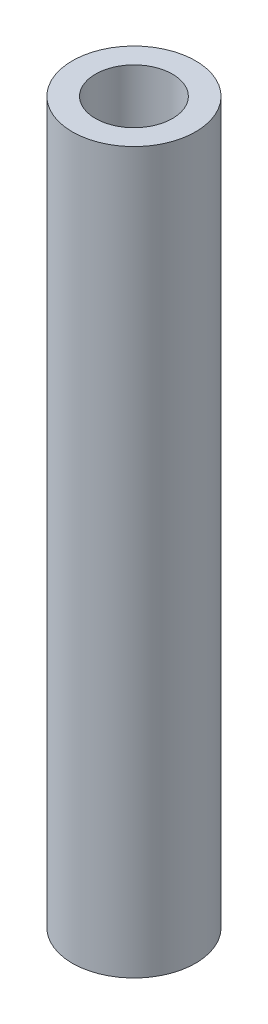
from build123d import *

# Parameters (mm, degrees)
SKETCH_1_R      = 4
SKETCH_1_R_2    = 2.5
EXTRUDE_1_DEPTH = 46.75


with BuildPart() as part:
    # 草图1 → 凸台-拉伸1 (new body)
    with BuildSketch(Plane(origin=(0, 0, 0), x_dir=(1, 0, 0), z_dir=(0, 1, 0))):
        with Locations(Location((0, 0, 0), (0, 0, 270))):
            Circle(SKETCH_1_R)
        with Locations(Location((0, 0, 0), (0, 0, 270))):
            Circle(SKETCH_1_R_2, mode=Mode.SUBTRACT)
    extrude(amount=EXTRUDE_1_DEPTH)


solid = part.part
